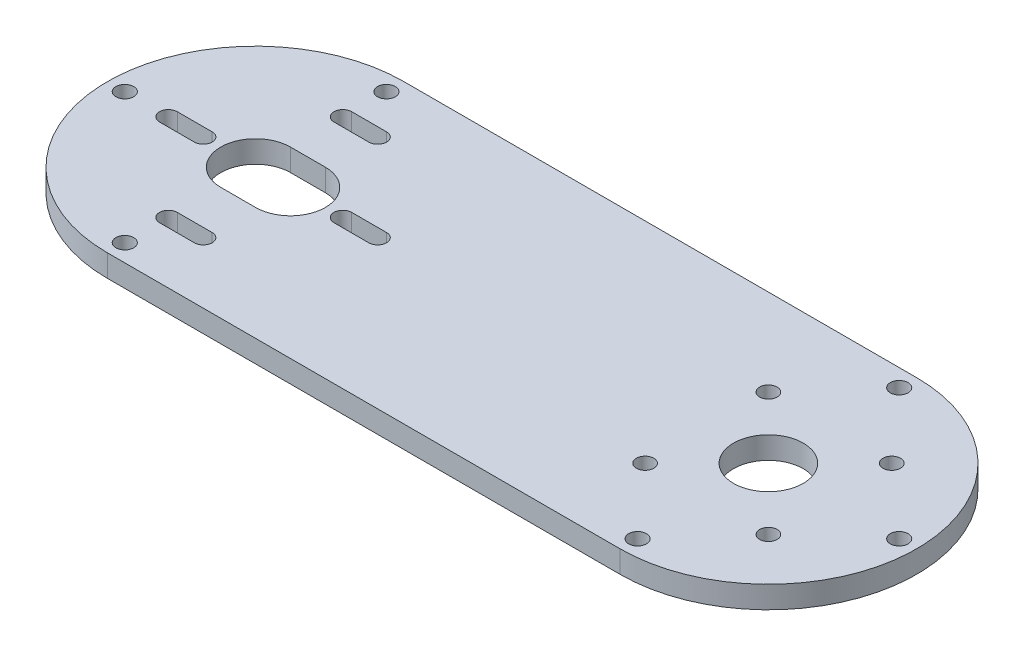
from build123d import *

# Parameters (mm, degrees)
SKETCH1_R           = 2.55
SKETCH1_R_2         = 2.5
SKETCH1_R_3         = 10
BOSS_EXTRUDE1_DEPTH = 6.35


with BuildPart() as part:
    # Sketch1 → Boss-Extrude1 (new body)
    with BuildSketch(Plane(origin=(0, 0, 0), x_dir=(1, 0, 0), z_dir=(0, 1, 0))):
        with BuildLine():
            Line((0, 42.5), (-147, 42.5))
            ThreePointArc((-147, 42.5), (-189.5, 0), (-147, -42.5))
            Line((-147, -42.5), (0, -42.5))
            ThreePointArc((0, -42.5), (42.5, 0), (0, 42.5))
        make_face()
        with BuildLine():
            Line((-147, 27.55), (-137, 27.55))
            ThreePointArc((-137, 27.55), (-134.45, 25), (-137, 22.45))
            Line((-137, 22.45), (-147, 22.45))
            ThreePointArc((-147, 22.45), (-149.55, 25), (-147, 27.55))
        make_face(mode=Mode.SUBTRACT)
        with Locations(Location((-147, 37.5, 0), (0, 0, 270))):
            Circle(SKETCH1_R, mode=Mode.SUBTRACT)
        with Locations(Location((-147, -37.5, 0), (0, 0, 270))):
            Circle(SKETCH1_R, mode=Mode.SUBTRACT)
        with BuildLine():
            ThreePointArc((-147, -27.55), (-149.55, -25), (-147, -22.45))
            Line((-147, -22.45), (-137, -22.45))
            ThreePointArc((-137, -22.45), (-134.45, -25), (-137, -27.55))
            Line((-137, -27.55), (-147, -27.55))
        make_face(mode=Mode.SUBTRACT)
        with Locations(Location((-184.5, 0, 0), (0, 0, 270))):
            Circle(SKETCH1_R, mode=Mode.SUBTRACT)
        with BuildLine():
            ThreePointArc((-172, -2.55), (-174.55, 0), (-172, 2.55))
            Line((-172, 2.55), (-162, 2.55))
            ThreePointArc((-162, 2.55), (-159.45, 0), (-162, -2.55))
            Line((-162, -2.55), (-172, -2.55))
        make_face(mode=Mode.SUBTRACT)
        with BuildLine():
            ThreePointArc((-147, -10), (-157, 0), (-147, 10))
            Line((-147, 10), (-137, 10))
            ThreePointArc((-137, 10), (-127, 0), (-137, -10))
            Line((-137, -10), (-147, -10))
        make_face(mode=Mode.SUBTRACT)
        with BuildLine():
            ThreePointArc((-122, -2.55), (-124.55, 0), (-122, 2.55))
            Line((-122, 2.55), (-112, 2.55))
            ThreePointArc((-112, 2.55), (-109.45, 0), (-112, -2.55))
            Line((-112, -2.55), (-122, -2.55))
        make_face(mode=Mode.SUBTRACT)
        with Locations(Location((0, 37.5, 0), (0, 0, 270))):
            Circle(SKETCH1_R, mode=Mode.SUBTRACT)
        with Locations(Location((0, -37.5, 0), (0, 0, 270))):
            Circle(SKETCH1_R, mode=Mode.SUBTRACT)
        with Locations(Location((-17.67766953, -17.67766953, 0), (0, 0, 270))):
            Circle(SKETCH1_R_2, mode=Mode.SUBTRACT)
        with Locations(Location((17.67766953, -17.67766953, 0), (0, 0, 270))):
            Circle(SKETCH1_R_2, mode=Mode.SUBTRACT)
        with Locations(Location((-17.67766953, 17.67766953, 0), (0, 0, 270))):
            Circle(SKETCH1_R_2, mode=Mode.SUBTRACT)
        with Locations(Location((0, 0, 0), (0, 0, 270))):
            Circle(SKETCH1_R_3, mode=Mode.SUBTRACT)
        with Locations(Location((37.5, 0, 0), (0, 0, 270))):
            Circle(SKETCH1_R, mode=Mode.SUBTRACT)
        with Locations(Location((17.67766953, 17.67766953, 0), (0, 0, 270))):
            Circle(SKETCH1_R_2, mode=Mode.SUBTRACT)
    extrude(amount=-BOSS_EXTRUDE1_DEPTH)


solid = part.part
